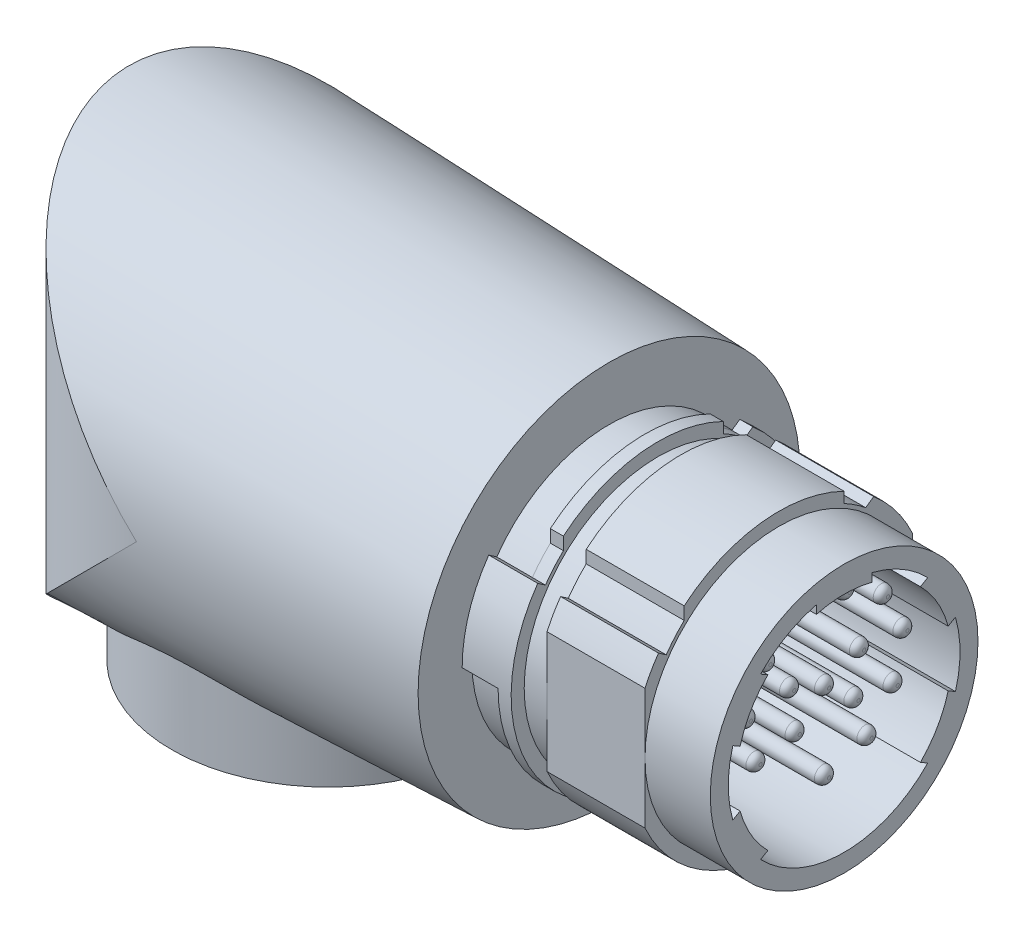
from build123d import *

# Parameters (mm, degrees)
EXTRUDE3_DEPTH    = 42.291
SKETCH2_R         = 12.192
EXTRUDE2_DEPTH    = 7.62
EXTRUDE4_REACH    = 68.174
SKETCH7_R         = 9.017
EXTRUDE5_DEPTH    = 13.97
EXTRUDE6_START    = 2.794
EXTRUDE6_DEPTH    = 2.794
SKETCH9_W         = 5.08
SKETCH9_H         = 12.7
EXTRUDE7_DEPTH    = 12.7
EXTRUDE8_DEPTH    = 13.97
CIRPATTERN1_COUNT = 6
SKETCH11_R        = 0.635
EXTRUDE9_DEPTH    = 12.8016
SKETCH12_R        = 0.635
EXTRUDE10_DEPTH   = 12.8016
FILLET1_R         = 0.508


with BuildPart() as part:
    # Sketch3 → Revolve1 (revolve)
    with BuildSketch(Plane.XY, mode=Mode.PRIVATE) as revolve1_sk:
        Polygon((-15.494, 16.0655), (-15.494, 32.258), (21.844, 30.9245), (21.844, 28.7655), (40.132, 28.7655), (40.132, 16.0655), align=None)
    revolve(revolve1_sk.sketch.rotate(Axis((-15.494, 16.0655, 0), (1, 0, 0)), 90), axis=Axis((-15.494, 16.0655, 0), (1, 0, 0)))

    # Sketch4 → Extrude3 (cut, symmetric)
    with BuildSketch(Plane(origin=(0, 0, 0), x_dir=(1, 0, 0), z_dir=(0, 1, 0))):
        with BuildLine():
            Line((0.688183019, 15.614564892), (0.688183019, 19.05))
            Line((0.688183019, 19.05), (-24.711816981, 19.05))
            Line((-24.711816981, 19.05), (-24.711816981, -19.05))
            Line((-24.711816981, -19.05), (0.688183019, -19.05))
            Line((0.688183019, -19.05), (0.688183019, -15.614564892))
            ThreePointArc((0.688183019, -15.614564892), (-15.494, 0), (0.688183019, 15.614564892))
        make_face()
    extrude(amount=EXTRUDE3_DEPTH, both=True, mode=Mode.SUBTRACT)

    # Sketch2 → Extrude2 (add)
    with BuildSketch(Plane(origin=(0, 0, 0), x_dir=(1, 0, 0), z_dir=(0, 1, 0))):
        Circle(SKETCH2_R)
    extrude(amount=EXTRUDE2_DEPTH)

    # Sketch5 → Cut-Revolve1 (revolve, cut)
    with BuildSketch(Plane.XY, mode=Mode.PRIVATE) as cut_revolve1_sk:
        Polygon((21.844, 26.7335), (24.638, 26.7335), (24.638, 27.4955), (25.654, 27.4955), (25.654, 26.4795), (27.432, 26.4795), (27.432, 27.4955), (35.052, 27.4955), (35.052, 26.4795), (40.132, 26.4795), (40.132, 28.7655), (21.844, 28.7655), align=None)
    revolve(cut_revolve1_sk.sketch.rotate(Axis((0.688183019, 16.0655, 0), (1, 0, 0)), 90), axis=Axis((0.688183019, 16.0655, 0), (1, 0, 0)), mode=Mode.SUBTRACT)

    # Sketch6 → Extrude4 (cut, up to next)
    with BuildSketch(Plane(origin=(40.132, 0, 0), x_dir=(0, 0, -1), z_dir=(1, 0, 0)), mode=Mode.PRIVATE) as extrude4_sk1:
        with BuildLine():
            Line((-7.366, 24.805462471), (-7.366, 23.822583588))
            ThreePointArc((-7.366, 23.822583588), (-8.104968608, 23.046888519), (-8.76264144, 22.201167591))
            Line((-8.76264144, 22.201167591), (-9.362907866, 22.621478667))
            ThreePointArc((-9.362907866, 22.621478667), (-8.435433357, 23.778370029), (-7.366, 24.805462471))
        make_face()
    extrude4_tool1 = extrude(extrude4_sk1.sketch, amount=-EXTRUDE4_REACH, mode=Mode.PRIVATE) & part.part
    # Sketch6 → Extrude4 (cut, up to next)
    with BuildSketch(Plane(origin=(40.132, 0, 0), x_dir=(0, 0, -1), z_dir=(1, 0, 0)), mode=Mode.PRIVATE) as extrude4_sk2:
        with BuildLine():
            Line((6.7564, 24.358952889), (7.378733083, 24.794715205))
            ThreePointArc((7.378733083, 24.794715205), (6.274943894, 25.619032285), (5.08, 26.30456734))
            Line((5.08, 26.30456734), (5.08, 25.479526863))
            ThreePointArc((5.08, 25.479526863), (5.944662543, 24.958828344), (6.7564, 24.358952889))
        make_face()
    extrude4_tool2 = extrude(extrude4_sk2.sketch, amount=-EXTRUDE4_REACH, mode=Mode.PRIVATE) & part.part
    # Sketch6 → Extrude4 (cut, up to next)
    with BuildSketch(Plane(origin=(40.132, 0, 0), x_dir=(0, 0, -1), z_dir=(1, 0, 0)), mode=Mode.PRIVATE) as extrude4_sk3:
        with BuildLine():
            Line((0.254, 5.371305978), (0.254, 4.638322571))
            ThreePointArc((0.254, 4.638322571), (2.459443831, 4.903240549), (4.572, 5.589731961))
            Line((4.572, 5.589731961), (3.859344319, 6.088738842))
            ThreePointArc((3.859344319, 6.088738842), (2.087720731, 5.573992771), (0.254, 5.371305978))
        make_face()
    extrude4_tool3 = extrude(extrude4_sk3.sketch, amount=-EXTRUDE4_REACH, mode=Mode.PRIVATE) & part.part
    add(extrude4_tool1.solids().sort_by_distance((40.132, 23.417127, 8.259947))[0], mode=Mode.SUBTRACT)
    add(extrude4_tool1.solids().sort_by_distance((40.132, 23.417127, 8.259947))[1], mode=Mode.SUBTRACT)
    add(extrude4_tool2.solids().sort_by_distance((40.132, 25.287842, -6.106057))[0], mode=Mode.SUBTRACT)
    add(extrude4_tool2.solids().sort_by_distance((40.132, 25.287842, -6.106057))[1], mode=Mode.SUBTRACT)
    add(extrude4_tool3.solids().sort_by_distance((40.132, 5.289374, -2.266983))[0], mode=Mode.SUBTRACT)
    add(extrude4_tool3.solids().sort_by_distance((40.132, 5.289374, -2.266983))[1], mode=Mode.SUBTRACT)

    # Sketch7 → Extrude5 (cut)
    with BuildSketch(Plane(origin=(40.132, 0, 0), x_dir=(0, 0, -1), z_dir=(1, 0, 0))):
        with Locations((0, 16.0655)):
            Circle(SKETCH7_R)
    extrude(amount=-EXTRUDE5_DEPTH, mode=Mode.SUBTRACT)

    # Sketch8 → Extrude6 (add)
    with BuildSketch(Plane(origin=(21.844, 0, 0), x_dir=(0, 0, -1), z_dir=(1, 0, 0)).offset(EXTRUDE6_START)):
        with BuildLine():
            Line((-9.362907866, 22.621478667), (-8.76264144, 22.201167591))
            Line((-8.76264144, 22.201167591), (-8.738714008, 22.184413423))
            ThreePointArc((-8.738714008, 22.184413423), (-10.174252431, 19.273429469), (-10.668, 16.0655))
            Line((-10.668, 16.0655), (-11.43, 16.0655))
            ThreePointArc((-11.43, 16.0655), (-10.900984747, 19.502567288), (-9.362907866, 22.621478667))
        make_face()
        with BuildLine():
            Line((4.572, 5.589731961), (3.830515001, 6.108925347))
            ThreePointArc((3.830515001, 6.108925347), (6.571018978, 7.661457306), (8.738714008, 9.946586577))
            Line((8.738714008, 9.946586577), (9.362907866, 9.509521333))
            ThreePointArc((9.362907866, 9.509521333), (7.237858902, 7.219127946), (4.572, 5.589731961))
        make_face()
    extrude(amount=-EXTRUDE6_DEPTH)

    # Sketch9 → Extrude7 (cut)
    with BuildSketch(Plane(origin=(40.132, 0, 0), x_dir=(0, 0, -1), z_dir=(1, 0, 0))):
        with Locations((-12.954, 16.0655)):
            Rectangle(SKETCH9_W, SKETCH9_H)
        with Locations((12.954, 16.0655)):
            Rectangle(SKETCH9_W, SKETCH9_H)
    extrude(amount=-EXTRUDE7_DEPTH, mode=Mode.SUBTRACT)

    # Sketch10 → Extrude8 (add)
    with BuildSketch(Plane(origin=(40.132, 0, 0), x_dir=(0, 0, -1), z_dir=(1, 0, 0))):
        with BuildLine():
            Line((-2.159, 24.820213473), (-2.159, 24.164675452))
            ThreePointArc((-2.159, 24.164675452), (0, 24.4475), (2.159, 24.164675452))
            Line((2.159, 24.164675452), (2.159, 24.820213473))
            ThreePointArc((2.159, 24.820213473), (0, 25.0825), (-2.159, 24.820213473))
        make_face()
    extrude8 = extrude(amount=-EXTRUDE8_DEPTH)

    # CirPattern1: Extrude8 ×6 about axis, 1 skipped
    cirpattern1_axis = Axis((0, 16.0655, 0), (-1, 0, 0))
    add([extrude8.rotate(cirpattern1_axis, i * 360 / CIRPATTERN1_COUNT) for i in range(1, CIRPATTERN1_COUNT) if i not in (3,)])

    # Sketch11 → Extrude9 (add)
    with BuildSketch(Plane(origin=(26.162, 0, 0), x_dir=(0, 0, -1), z_dir=(1, 0, 0))):
        with Locations((-2.7178, 18.7325)):
            Circle(SKETCH11_R)
        with Locations((2.7178, 18.7325)):
            Circle(SKETCH11_R)
        with Locations((-2.286, 15.5575)):
            Circle(SKETCH11_R)
        with Locations((2.286, 15.5575)):
            Circle(SKETCH11_R)
        with Locations((0, 17.5387)):
            Circle(SKETCH11_R)
    extrude(amount=EXTRUDE9_DEPTH)

    # Sketch12 → Extrude10 (add)
    with BuildSketch(Plane(origin=(26.162, 0, 0), x_dir=(0, 0, -1), z_dir=(1, 0, 0))):
        with Locations((-6.096, 18.3515)):
            Circle(SKETCH12_R)
        with Locations((6.096, 18.3515)):
            Circle(SKETCH12_R)
        with Locations((4.572, 21.3995)):
            Circle(SKETCH12_R)
        with Locations((3.302, 12.5095)):
            Circle(SKETCH12_R)
        with Locations((0, 11.4935)):
            Circle(SKETCH12_R)
        with Locations((-4.572, 21.3995)):
            Circle(SKETCH12_R)
        with Locations((1.6002, 23.1775)):
            Circle(SKETCH12_R)
        with Locations((5.334, 15.0495)):
            Circle(SKETCH12_R)
        with Locations((-5.334, 15.0495)):
            Circle(SKETCH12_R)
    extrude(amount=EXTRUDE10_DEPTH)

    # Fillet1
    fillet1_edges = [part.edges().sort_by_distance(p)[0] for p in [
        (38.9636, 18.7325, 3.3528),
        (38.9636, 18.7325, -2.0828),
        (38.9636, 15.5575, 2.921),
        (38.9636, 15.5575, -1.651),
        (38.9636, 17.5387, 0.635),
        (38.9636, 18.3515, 6.731),
        (38.9636, 18.3515, -5.461),
        (38.9636, 12.5095, -2.667),
        (38.9636, 11.4935, 0.635),
        (38.9636, 21.3995, -3.937),
        (38.9636, 15.0495, -4.699),
        (38.9636, 15.0495, 5.969),
        (38.9636, 21.3995, 5.207),
        (38.9636, 23.1775, -0.9652),
    ]]
    fillet(fillet1_edges, radius=FILLET1_R)


solid = part.part
